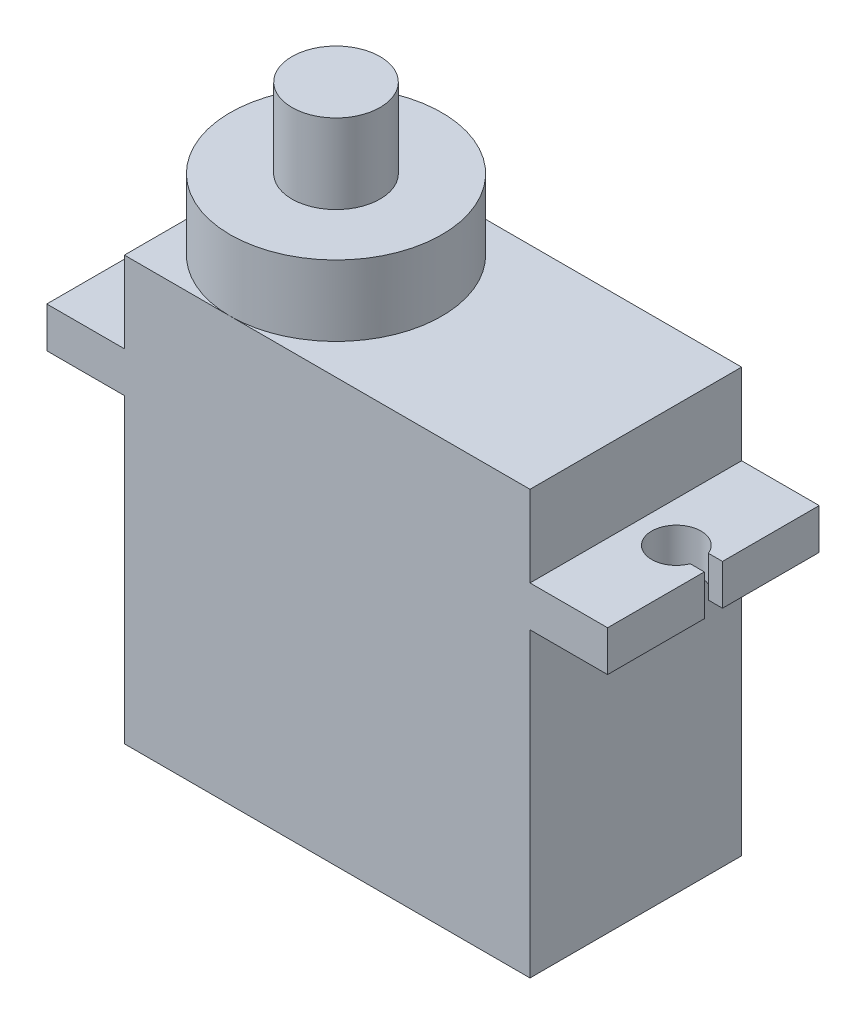
from build123d import *

# Parameters (mm, degrees)
CROQUIS1_W              = 23
CROQUIS1_H              = 12
SALIENTE_EXTRUIR1_DEPTH = 24
CROQUIS2_W              = 12
CROQUIS2_H              = 2.3
SALIENTE_EXTRUIR2_DEPTH = 4.4
CORTAR_EXTRUIR1_REACH   = 27.791
CROQUIS4_R              = 6
SALIENTE_EXTRUIR4_DEPTH = 4
CROQUIS5_R              = 2.5
SALIENTE_EXTRUIR5_DEPTH = 4.5


with BuildPart() as part:
    # Croquis1 → Saliente-Extruir1 (new body)
    with BuildSketch(Plane(origin=(0, 0, 0), x_dir=(1, 0, 0), z_dir=(0, 1, 0))):
        Rectangle(CROQUIS1_W, CROQUIS1_H)
    extrude(amount=SALIENTE_EXTRUIR1_DEPTH)

    # Croquis2 → Saliente-Extruir2 (add)
    with BuildSketch(Plane.ZY.offset(11.5)):
        with Locations((0, 18.25)):
            Rectangle(CROQUIS2_W, CROQUIS2_H)
    saliente_extruir2 = extrude(amount=SALIENTE_EXTRUIR2_DEPTH)

    # Croquis3 → Cortar-Extruir1 (cut, up to next)
    with BuildSketch(Plane(origin=(0, 19.4, 0), x_dir=(1, 0, 0), z_dir=(0, 1, 0)), mode=Mode.PRIVATE) as cortar_extruir1_sk1:
        with BuildLine():
            Line((-15.101550129, -0.515720139), (-15.9, -0.515720139))
            Line((-15.9, -0.515720139), (-15.9, 0.515720139))
            Line((-15.9, 0.515720139), (-15.101550129, 0.515720139))
            ThreePointArc((-15.101550129, 0.515720139), (-12.4, 0), (-15.101550129, -0.515720139))
        make_face()
    cortar_extruir1_tool1 = extrude(cortar_extruir1_sk1.sketch, amount=-CORTAR_EXTRUIR1_REACH, mode=Mode.PRIVATE) & part.part
    cortar_extruir1 = cortar_extruir1_tool1.solids().sort_by_distance((-13.989391, 19.4, 0))[0]
    add(cortar_extruir1, mode=Mode.SUBTRACT)

    # Simetría1: Saliente-Extruir2, Cortar-Extruir1 across plane
    add(saliente_extruir2.mirror(Plane(origin=(0, 0, 0), x_dir=(0, 0, 1), z_dir=(1, 0, 0))))
    add(cortar_extruir1.mirror(Plane(origin=(0, 0, 0), x_dir=(0, 0, 1), z_dir=(1, 0, 0))), mode=Mode.SUBTRACT)

    # Croquis4 → Saliente-Extruir4 (add)
    with BuildSketch(Plane(origin=(0, 24, 0), x_dir=(1, 0, 0), z_dir=(0, 1, 0))):
        with Locations(Location((-5.5, 0, 0), (0, 0, 270))):
            Circle(CROQUIS4_R)
    extrude(amount=SALIENTE_EXTRUIR4_DEPTH)

    # Croquis5 → Saliente-Extruir5 (add)
    with BuildSketch(Plane(origin=(0, 28, 0), x_dir=(1, 0, 0), z_dir=(0, 1, 0))):
        with Locations(Location((-5.5, 0, 0), (0, 0, 270))):
            Circle(CROQUIS5_R)
    extrude(amount=SALIENTE_EXTRUIR5_DEPTH)


solid = part.part
